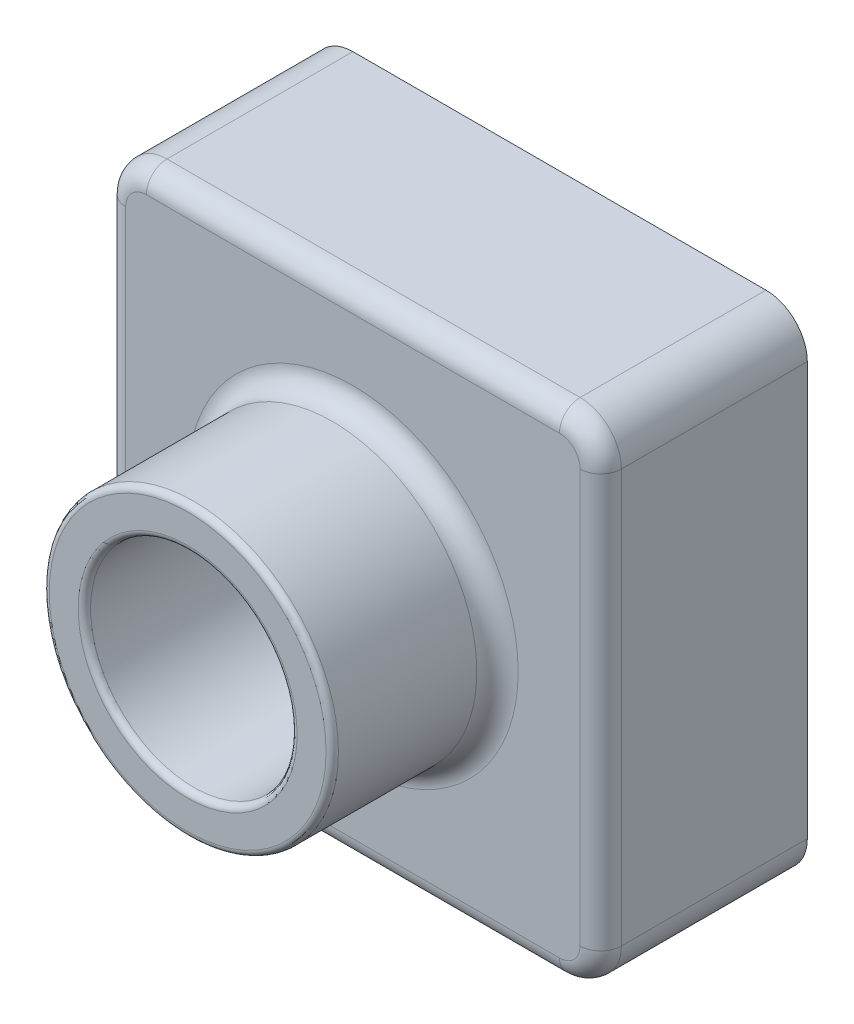
from build123d import *

# Parameters (mm, degrees)
SKETCH4_W           = 120
SKETCH4_H           = 120
BOSS_EXTRUDE2_DEPTH = 50
SKETCH5_R           = 35
BOSS_EXTRUDE3_DEPTH = 40
SKETCH6_R           = 25
CUT_EXTRUDE1_DEPTH  = 193.093727123
FILLET1_R           = 10
FILLET2_R           = 1.5
FILLET3_R           = 5
SHELL1_T            = -2


with BuildPart() as part:
    # Sketch4 → Boss-Extrude2 (new body)
    with BuildSketch(Plane.XY):
        with Locations((60, 60)):
            Rectangle(SKETCH4_W, SKETCH4_H)
    extrude(amount=BOSS_EXTRUDE2_DEPTH)

    # Sketch5 → Boss-Extrude3 (add)
    with BuildSketch(Plane.XY.offset(50)):
        with Locations((60, 60)):
            Circle(SKETCH5_R)
    extrude(amount=BOSS_EXTRUDE3_DEPTH)

    # Sketch6 → Cut-Extrude1 (cut, through all)
    with BuildSketch(Plane.XY.offset(90)):
        with Locations((60, 60)):
            Circle(SKETCH6_R)
    extrude(amount=-CUT_EXTRUDE1_DEPTH, mode=Mode.SUBTRACT)

    # Fillet1
    fillet1_edges = [part.edges().sort_by_distance(p)[0] for p in [
        (0, 120, 25),
        (120, 120, 25),
        (120, 0, 25),
        (0, 0, 25),
    ]]
    fillet(fillet1_edges, radius=FILLET1_R)

    # Fillet2
    fillet2_edges = [part.edges().sort_by_distance(p)[0] for p in [
        (25, 60, 90),
        (35, 60, 90),
    ]]
    fillet(fillet2_edges, radius=FILLET2_R)

    # Fillet3
    fillet3_edges = [part.edges().sort_by_distance(p)[0] for p in [
        (25, 60, 50),
        (0, 60, 50),
        (60, 120, 50),
        (60, 0, 50),
        (120, 60, 50),
        (117.071067812, 117.071067812, 50),
        (117.071067812, 2.928932188, 50),
        (2.928932188, 2.928932188, 50),
        (2.928932188, 117.071067812, 50),
    ]]
    fillet(fillet3_edges, radius=FILLET3_R)

    # Shell1
    shell1_openings = [part.faces().sort_by_distance(p)[0] for p in [
        (60, 1.697056275, 0),
    ]]
    offset(amount=SHELL1_T, openings=shell1_openings, kind=Kind.INTERSECTION)


solid = part.part
